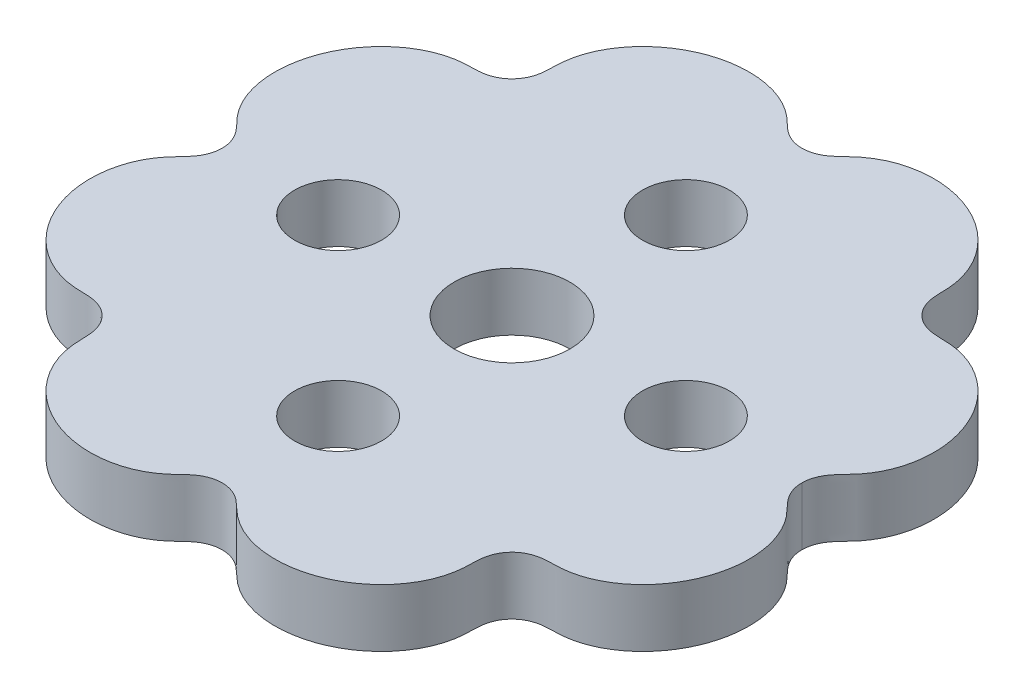
from build123d import *

# Parameters (mm, degrees)
BOSS_EXTRUDE4_DEPTH = 6.35
SKETCH8_R           = 6.35
CUT_EXTRUDE3_DEPTH  = 52.440090019
SKETCH9_R           = 4.7625
CUT_EXTRUDE4_DEPTH  = 6.35
CIRPATTERN1_COUNT   = 4


with BuildPart() as part:
    # Sketch5 → Boss-Extrude4 (new body)
    with BuildSketch(Plane(origin=(0, 0, 0), x_dir=(1, 0, 0), z_dir=(0, 1, 0))):
        with BuildLine():
            Line((31.75, 0), (-31.75, 0))
            add(Edge.make_bspline(
                [(31.75, 0), (31.75, -0.027776845), (31.750583752, -0.069349158), (31.752529604, -0.137238783), (31.759255701, -0.270555498), (31.769997993, -0.393253352), (31.787221149, -0.524909201), (31.817755186, -0.702295042), (31.856002994, -0.877045111), (31.913834916, -1.086266021), (31.998196969, -1.326921893), (32.128920184, -1.630922104), (32.32490506, -1.990438346), (32.599240141, -2.384228967), (32.959889561, -2.798622608), (33.344335858, -3.19320981), (33.751249013, -3.622999851), (34.15942531, -4.106892192), (34.553151332, -4.654110625), (34.920648303, -5.267351657), (35.316606739, -6.068421601), (35.690865683, -7.074642663), (35.983297148, -8.293830204), (36.126538526, -9.719028337), (36.085738806, -11.150507476), (35.867907682, -12.56570304), (35.475945204, -13.959017654), (34.911309026, -15.308843969), (34.176514851, -16.592428488), (33.275534228, -17.785212301), (32.227167058, -18.851149053), (31.044236261, -19.766153913), (29.905108081, -20.411317416), (28.866960855, -20.833977076), (27.969508557, -21.08831302), (27.32822541, -21.211393416), (26.772599791, -21.276230682), (26.275253596, -21.307544975), (25.837809362, -21.319772334), (25.368013965, -21.325990122), (24.865948859, -21.353669464), (24.239674397, -21.444529197), (23.513599496, -21.668579116), (22.669158581, -22.156089438), (22.011974501, -22.88088819), (21.629932343, -23.627576851), (21.43905675, -24.307494378), (21.360676209, -24.797729895), (21.329996484, -25.266942743), (21.321210203, -25.71130398), (21.312538804, -26.130102853), (21.293946977, -26.52318), (21.251498022, -27.013260439), (21.165621468, -27.597612273), (21.012747029, -28.269924442), (20.769838958, -29.019400457), (20.387278039, -29.926780862), (19.812038455, -30.960768631), (18.991990495, -32.073197009), (17.882699258, -33.196757029), (16.629894922, -34.157138118), (15.275346451, -34.932551001), (13.847931071, -35.518379303), (12.374322653, -35.91181192), (10.879792191, -36.111322783), (9.3717296, -36.113164471), (7.877077637, -35.90917091), (6.608157457, -35.543524796), (5.571756044, -35.091596393), (4.756891282, -34.621233456), (4.217507558, -34.243215135), (3.780610288, -33.886221447), (3.413605746, -33.553918027), (3.106013537, -33.258836495), (2.780984828, -32.945640654), (2.421104272, -32.632562315), (1.921074902, -32.270490191), (1.250607851, -31.928180863), (0.39369838, -31.712171566), (-0.631514334, -31.746462986), (-1.483023918, -32.021616831), (-2.142672726, -32.411973774), (-2.646595838, -32.821715294), (-3.023402195, -33.177431791), (-3.432246636, -33.574815183), (-3.89637565, -33.990176573), (-4.43155716, -34.402341089), (-5.044128964, -34.795286053), (-5.848099982, -35.220871487), (-6.862970973, -35.626700759), (-8.097866537, -35.94997098), (-9.546152065, -36.120549341), (-11.003919231, -36.099549654), (-12.44708337, -35.894366171), (-13.859002663, -35.511070029), (-15.218294672, -34.955348038), (-16.503584008, -34.23359521), (-17.692865575, -33.353218762), (-18.759652812, -32.32749086), (-19.680751861, -31.168676714), (-20.336808122, -30.051255467), (-20.773651766, -29.031411194), (-21.043495457, -28.148362219), (-21.179318366, -27.516401865), (-21.256036101, -26.967953542), (-21.297409676, -26.473352214), (-21.316273705, -26.034505425), (-21.322584619, -25.560451917), (-21.339039819, -25.051216794), (-21.408931229, -24.403327191), (-21.606798527, -23.654306163), (-22.027887394, -22.854742671), (-22.745050481, -22.112275511), (-23.513673463, -21.668536419), (-24.239626751, -21.44455674), (-24.865979098, -21.353651976), (-25.367988308, -21.326004963), (-25.837825405, -21.319763054), (-26.275245708, -21.307549538), (-26.772604348, -21.276228046), (-27.328222655, -21.21139501), (-27.969509897, -21.088312244), (-28.866960087, -20.833977521), (-29.905108567, -20.411317134), (-31.044235962, -19.766154086), (-32.227167227, -18.851148955), (-33.275534128, -17.785212359), (-34.176514913, -16.592428452), (-34.911308989, -15.308843991), (-35.475945227, -13.95901764), (-35.867907668, -12.565703049), (-36.085738815, -11.150507469), (-36.126538521, -9.719028343), (-35.983297151, -8.293830197), (-35.69086568, -7.074642671), (-35.316606741, -6.068421589), (-34.920648302, -5.267351677), (-34.553151333, -4.654110584), (-34.15942531, -4.106892264), (-33.751249013, -3.622999732), (-33.344335858, -3.193210007), (-32.959889561, -2.798622268), (-32.599240141, -2.384229473), (-32.32490506, -1.990437602), (-32.128920184, -1.630923126), (-31.998196969, -1.326920363), (-31.923711227, -1.114441517), (-31.871911432, -0.934597733), (-31.836878588, -0.789654474), (-31.812666179, -0.672688853), (-31.792310156, -0.554795581), (-31.775846454, -0.437282937), (-31.764738594, -0.333742435), (-31.757642718, -0.238505689), (-31.752529603, -0.137171321), (-31.750583752, -0.069340206), (-31.75, -0.027776845), (-31.75, 0)],
                knots=[0.070894517, 0.070894517, 0.070894517, 0.070894517, 0.070894517, 0.071767646, 0.072204211, 0.072640776, 0.07425025, 0.075054987, 0.075859724, 0.077469199, 0.079078673, 0.080906174, 0.082733675, 0.086388678, 0.090104372, 0.093820066, 0.09753576, 0.101251455, 0.106067558, 0.110883662, 0.115699765, 0.120515868, 0.130148054, 0.13978024, 0.149412788, 0.159045337, 0.168677851, 0.178310366, 0.188364038, 0.19841771, 0.208471457, 0.218525204, 0.228578854, 0.238632503, 0.24365898, 0.248685457, 0.253711935, 0.256225173, 0.258738412, 0.26212647, 0.265514528, 0.268902586, 0.272290644, 0.279170534, 0.285884874, 0.294871204, 0.298212154, 0.301553105, 0.304894056, 0.308235007, 0.310888294, 0.313541582, 0.316194869, 0.318848156, 0.324154731, 0.329461305, 0.334768017, 0.340074729, 0.350688153, 0.361301522, 0.371914892, 0.382528479, 0.393142066, 0.40328245, 0.413422835, 0.423563168, 0.433703501, 0.443843702, 0.453983903, 0.459053806, 0.464123709, 0.469193612, 0.471728563, 0.474263515, 0.477477501, 0.480691488, 0.483905475, 0.487119461, 0.494104238, 0.500874807, 0.507427, 0.514443489, 0.517936957, 0.521430425, 0.524923893, 0.528417361, 0.533319598, 0.538221835, 0.543124071, 0.548026308, 0.5578317, 0.567637092, 0.577442207, 0.587247322, 0.597052616, 0.606857911, 0.616810305, 0.6267627, 0.636715303, 0.646667906, 0.656620017, 0.666572129, 0.67154809, 0.676524052, 0.681500014, 0.683987994, 0.686475975, 0.689910604, 0.693345232, 0.69677986, 0.700214489, 0.707466237, 0.714115126, 0.720829466, 0.727709356, 0.731097414, 0.734485472, 0.73787353, 0.741261588, 0.743774827, 0.746288065, 0.751314543, 0.75634102, 0.761367497, 0.771421146, 0.781474796, 0.791528543, 0.80158229, 0.811635962, 0.821689634, 0.831322149, 0.840954663, 0.850587212, 0.86021976, 0.869851946, 0.879484132, 0.884300235, 0.889116338, 0.893932442, 0.898748545, 0.90246424, 0.906179934, 0.909895628, 0.913611322, 0.917266325, 0.919093826, 0.920921327, 0.922530801, 0.923335539, 0.924140276, 0.924945013, 0.92574975, 0.926554487, 0.927359224, 0.927795789, 0.928232354, 0.929105483, 0.929105483, 0.929105483, 0.929105483, 0.929105483], degree=4))
        make_face()
    boss_extrude4 = extrude(amount=BOSS_EXTRUDE4_DEPTH)

    # Mirror1: Boss-Extrude4 across plane
    add(boss_extrude4.mirror(Plane(origin=(0, 6.35, 0), x_dir=(1, 0, 0), z_dir=(0, 0, -1))))

    # Sketch8 → Cut-Extrude3 (cut, through all)
    with BuildSketch(Plane(origin=(0, 0, 0), x_dir=(1, 0, 0), z_dir=(0, 1, 0))):
        with Locations(Location((0, 0, 0), (0, 0, 270))):
            Circle(SKETCH8_R)
    extrude(amount=CUT_EXTRUDE3_DEPTH, mode=Mode.SUBTRACT)

    # Sketch9 → Cut-Extrude4 (cut)
    with BuildSketch(Plane(origin=(0, 6.35, 0), x_dir=(1, 0, 0), z_dir=(0, 1, 0))):
        with Locations(Location((-19.05, 0, 0), (0, 0, 270))):
            Circle(SKETCH9_R)
    cut_extrude4 = extrude(amount=-CUT_EXTRUDE4_DEPTH, mode=Mode.SUBTRACT)

    # CirPattern1: Cut-Extrude4 ×4 about axis
    cirpattern1_axis = Axis((0, 0, 0), (0, 1, 0))
    for i in range(1, CIRPATTERN1_COUNT):
        add(cut_extrude4.rotate(cirpattern1_axis, i * 360 / CIRPATTERN1_COUNT), mode=Mode.SUBTRACT)


solid = part.part
